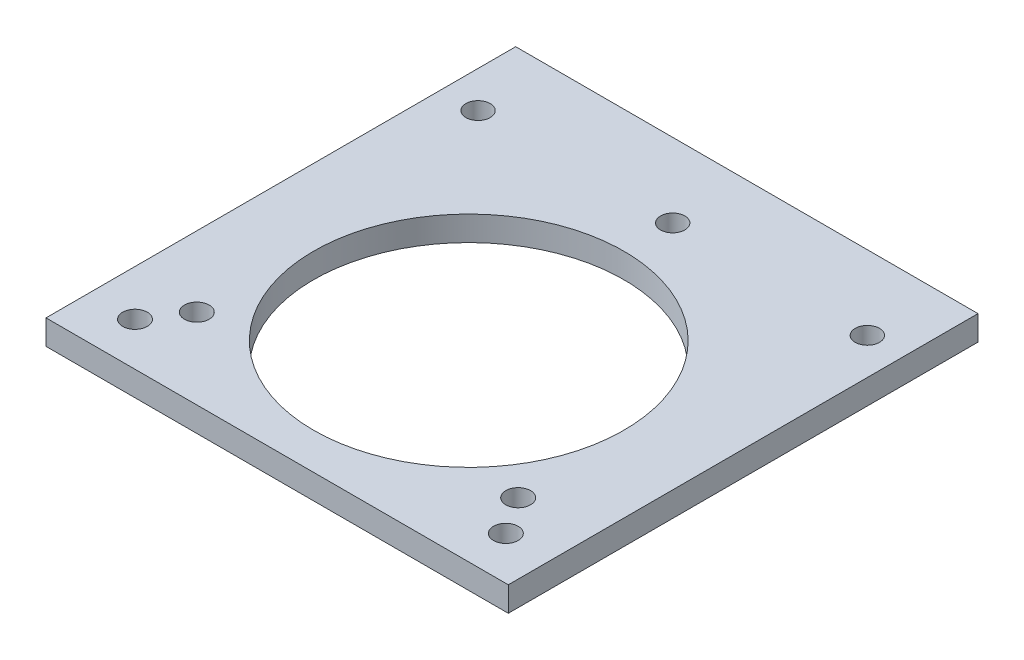
from build123d import *

# Parameters (mm, degrees)
SKETCH2_W                 = 95
SKETCH2_H                 = 96.52
BOSS_EXTRUDE3_DEPTH       = 5.08
SKETCH3_R                 = 31.88
CUT_EXTRUDE1_DEPTH        = 78.447905072
M6X1_0_TAPPED_HOLE1_D     = 5
M6X1_0_TAPPED_HOLE1_DEPTH = 5.08
M6X1_0_TAPPED_HOLE1_TIP   = 1.502151548
SKETCH7_R                 = 2.54
CUT_EXTRUDE2_DEPTH        = 7.62


with BuildPart() as part:
    # Sketch2 → Boss-Extrude3 (new body)
    with BuildSketch(Plane(origin=(0, 0, 0), x_dir=(1, 0, 0), z_dir=(0, 1, 0))):
        with Locations((0, -12.7)):
            Rectangle(SKETCH2_W, SKETCH2_H)
    extrude(amount=BOSS_EXTRUDE3_DEPTH)

    # Sketch3 → Cut-Extrude1 (cut, through all)
    with BuildSketch(Plane(origin=(0, 5.08, 0), x_dir=(1, 0, 0), z_dir=(0, 1, 0))):
        with Locations(Location((0, -21.59, 0), (0, 0, 270))):
            Circle(SKETCH3_R)
    extrude(amount=-CUT_EXTRUDE1_DEPTH, mode=Mode.SUBTRACT)

    # M6x1.0 Tapped Hole1
    with Locations(Plane(origin=(0, 5.08, 0), x_dir=(1, 0, 0), z_dir=(0, 1, 0))):
        with Locations((-40, 20.32), (40, 20.32), (0, 20.32)):
            Hole(M6X1_0_TAPPED_HOLE1_D / 2, depth=M6X1_0_TAPPED_HOLE1_DEPTH)
            with Locations((0, 0, -(M6X1_0_TAPPED_HOLE1_DEPTH + M6X1_0_TAPPED_HOLE1_TIP / 2))):  # 118° drill point
                Cone(0, M6X1_0_TAPPED_HOLE1_D / 2, M6X1_0_TAPPED_HOLE1_TIP, mode=Mode.SUBTRACT)

    # Sketch7 → Cut-Extrude2 (cut)
    with BuildSketch(Plane(origin=(0, 5.08, 0), x_dir=(1, 0, 0), z_dir=(0, 1, 0))):
        with Locations(Location((-33.02, -44.45, 0), (0, 0, 270))):
            Circle(SKETCH7_R)
        with Locations(Location((33.02, -44.45, 0), (0, 0, 270))):
            Circle(SKETCH7_R)
        with Locations(Location((-38.1, -52.07, 0), (0, 0, 270))):
            Circle(SKETCH7_R)
        with Locations(Location((38.1, -52.07, 0), (0, 0, 270))):
            Circle(SKETCH7_R)
    extrude(amount=-CUT_EXTRUDE2_DEPTH, mode=Mode.SUBTRACT)


solid = part.part
